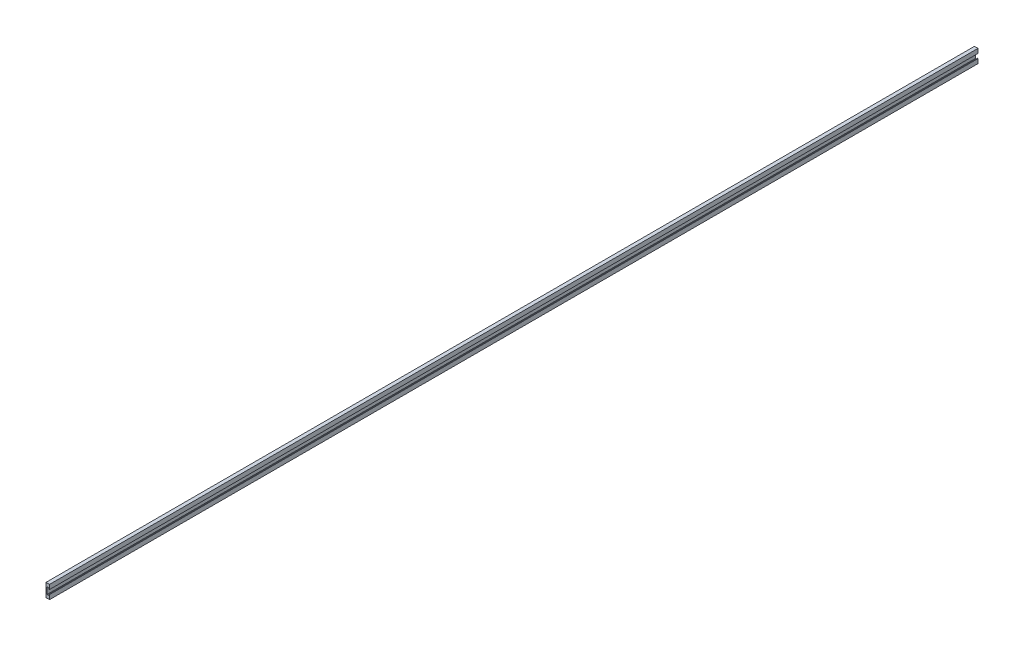
from build123d import *

# Parameters (mm, degrees)
BOSS_EXTRUDE1_DEPTH = 1050


with BuildPart() as part:
    # Sketch1 → Boss-Extrude1 (new, symmetric)
    with BuildSketch(Plane.XY):
        Polygon((0, 0), (-8, 0), (-8, 30), (0, 30), (0, 22.5), (0, 20), (-1.5, 20), (-1.5, 22.5), (-5.5, 22.5), (-5.5, 7.5), (-1.5, 7.5), (-1.5, 10), (0, 10), (0, 7.5), align=None)
    extrude(amount=BOSS_EXTRUDE1_DEPTH, both=True)


solid = part.part
